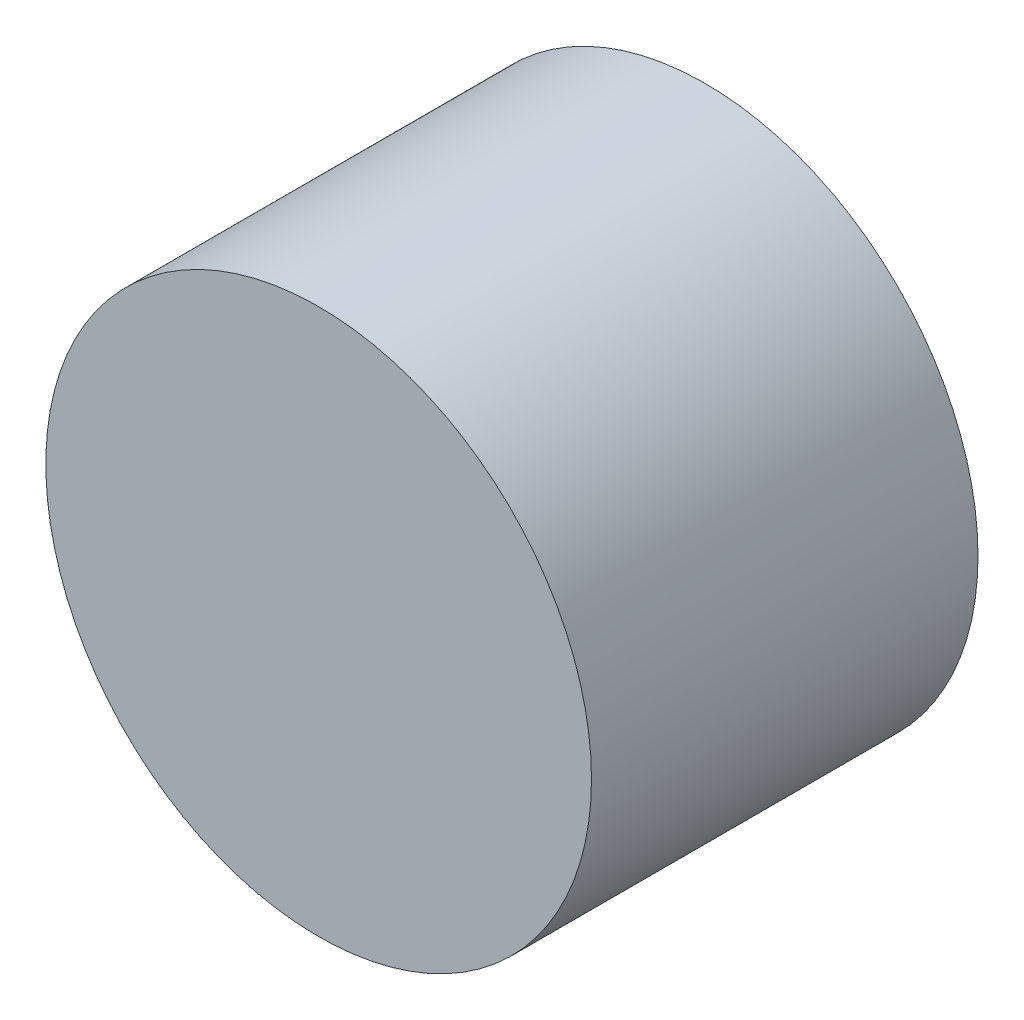
from build123d import *

# Parameters (mm, degrees)
SKIZZE1_R                       = 6
COMPONENT_OUTLINE_DEPTH         = 8.5
SKIZZE2_R                       = 0.5
AUFSATZ_LINEAR_AUSTRAGEN1_DEPTH = 1.7


with BuildPart() as part:
    # Skizze1 → Component_Outline (new body)
    with BuildSketch(Plane.XY):
        Circle(SKIZZE1_R)
    extrude(amount=COMPONENT_OUTLINE_DEPTH)

    # Skizze2 → Aufsatz-Linear austragen1 (add)
    with BuildSketch(Plane(origin=(0, 0, 0), x_dir=(-1, 0, 0), z_dir=(0, 0, -1))):
        with Locations(Location((-2.29, 0, 0), (0, 0, 180))):
            Circle(SKIZZE2_R)
    aufsatz_linear_austragen1 = extrude(amount=AUFSATZ_LINEAR_AUSTRAGEN1_DEPTH)

    # Spiegeln1: Aufsatz-Linear austragen1 across plane
    add(aufsatz_linear_austragen1.mirror(Plane(origin=(0, 0, 0), x_dir=(0, 0, 1), z_dir=(1, 0, 0))))


solid = part.part
